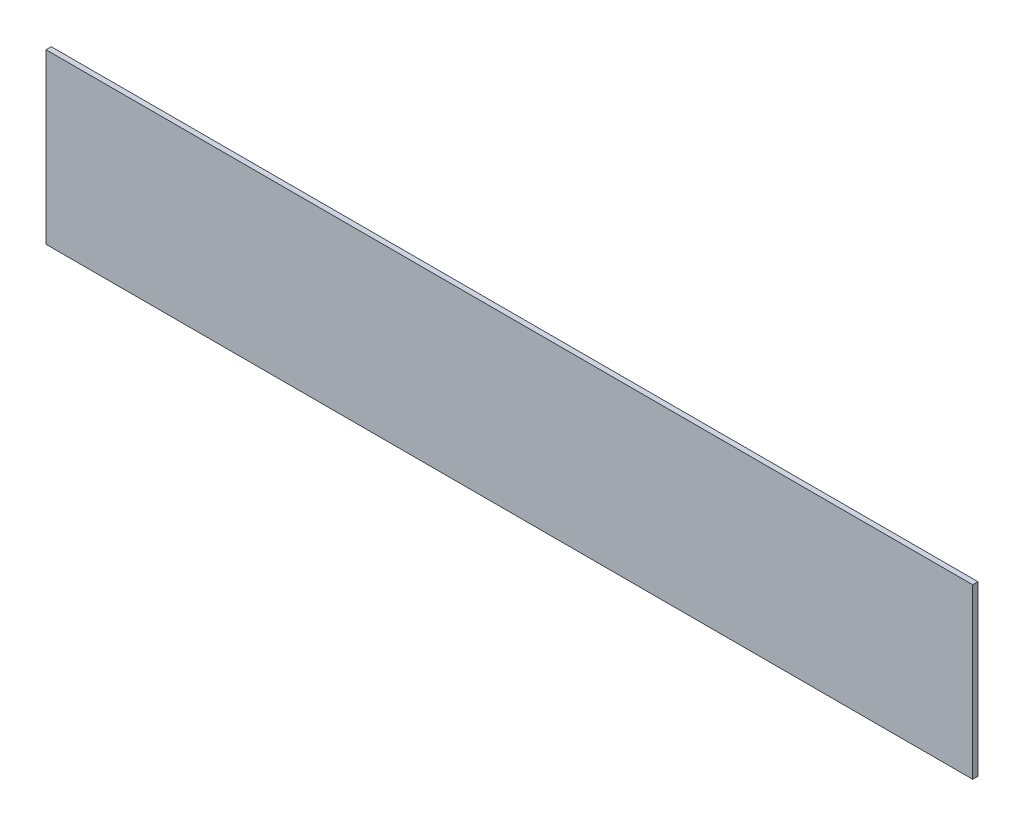
from build123d import *

# Parameters (mm, degrees)
SKETCH2_W           = 279.4
SKETCH2_H           = 50.8
BOSS_EXTRUDE1_DEPTH = 1.5875


with BuildPart() as part:
    # Sketch2 → Boss-Extrude1 (new body)
    with BuildSketch(Plane.XY):
        with Locations((139.7, 25.4)):
            Rectangle(SKETCH2_W, SKETCH2_H)
    extrude(amount=BOSS_EXTRUDE1_DEPTH)


solid = part.part
